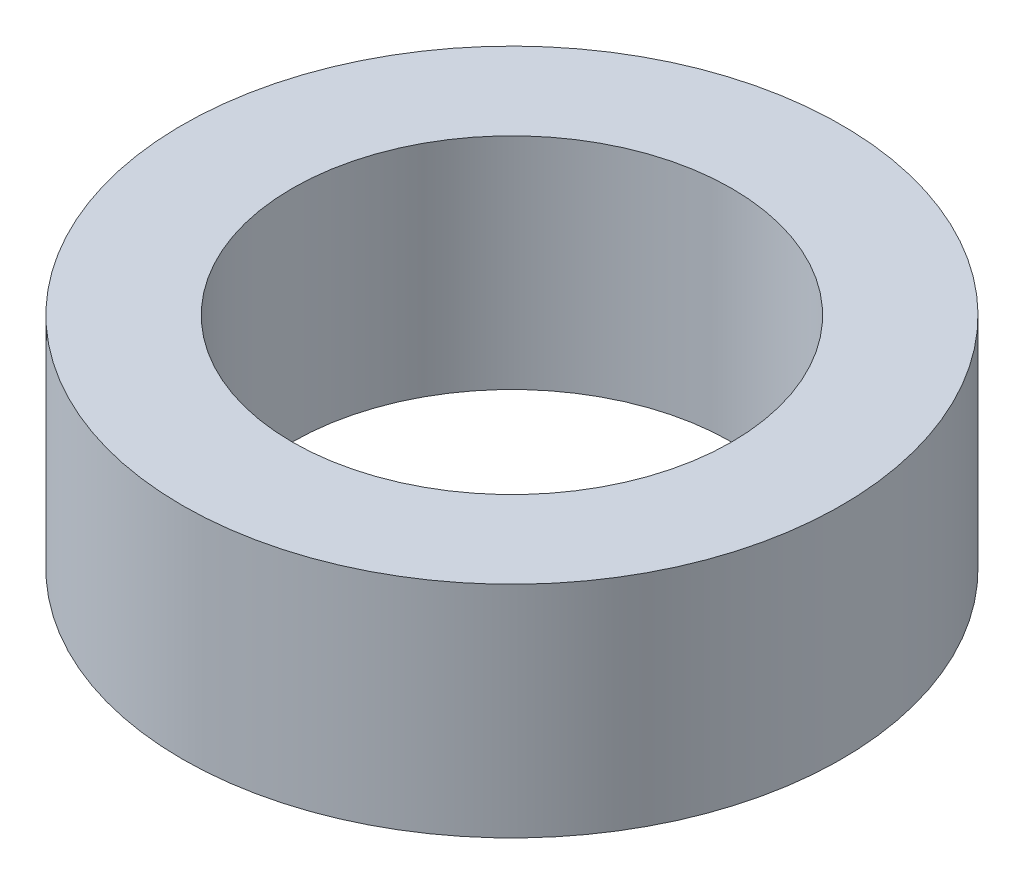
from build123d import *

# Parameters (mm, degrees)
SKETCH1_R           = 4.7625
SKETCH1_R_2         = 3.175
BOSS_EXTRUDE1_DEPTH = 3.175


with BuildPart() as part:
    # Sketch1 → Boss-Extrude1 (new body)
    with BuildSketch(Plane(origin=(0, 0, 0), x_dir=(1, 0, 0), z_dir=(0, 1, 0))):
        with Locations(Location((0, 0, 0), (0, 0, 270))):
            Circle(SKETCH1_R)
        with Locations(Location((0, 0, 0), (0, 0, 270))):
            Circle(SKETCH1_R_2, mode=Mode.SUBTRACT)
    extrude(amount=BOSS_EXTRUDE1_DEPTH)


solid = part.part
